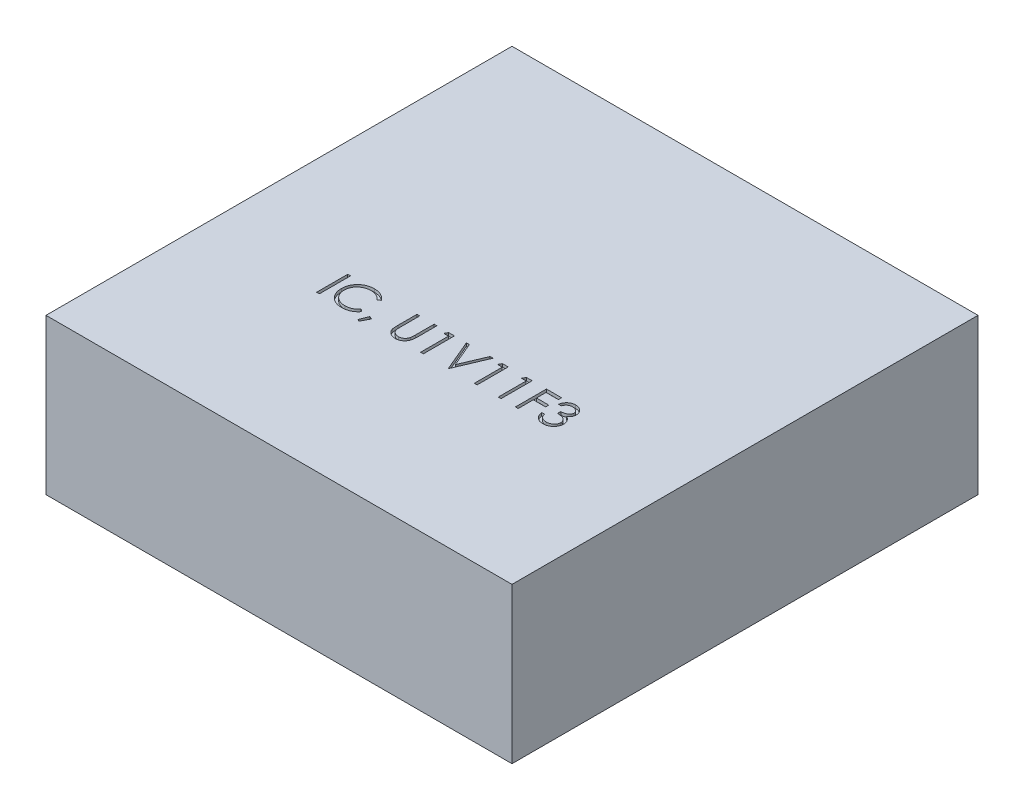
from build123d import *

# Parameters (mm, degrees)
BASES_W          = 3
BASES_H          = 3
BASE_DEPTH       = 1
PARTNUMBERS_W    = 0.017948718
PARTNUMBERS_H    = 0.2
PARTNUMBER_DEPTH = 0.02


with BuildPart() as part:
    # BaseS → Base (new body)
    with BuildSketch(Plane(origin=(0, 0, 0), x_dir=(1, 0, 0), z_dir=(0, 1, 0))):
        Rectangle(BASES_W, BASES_H)
    extrude(amount=BASE_DEPTH)

    # PartNumberS → PartNumber (cut)
    with BuildSketch(Plane(origin=(0, 1, 0), x_dir=(1, 0, 0), z_dir=(0, 1, 0))):
        with BuildLine():
            Line((0.662820513, -0.346153846), (0.644871795, -0.346153846))
            add(Edge.make_bspline(
                [(0.644871795, -0.346153846), (0.645358055, -0.344140561), (0.646308654, -0.340204754), (0.648291372, -0.334581482), (0.650451329, -0.329260138), (0.653044993, -0.324340362), (0.655874064, -0.319723282), (0.659115363, -0.315513618), (0.662619347, -0.311604306), (0.666495058, -0.308134978), (0.670559553, -0.304993393), (0.674870103, -0.302314819), (0.679339982, -0.300010581), (0.684000161, -0.298112282), (0.688864514, -0.296682252), (0.693889064, -0.295644721), (0.699086978, -0.294970943), (0.702615412, -0.294905185), (0.704407051, -0.294871795)],
                knots=[0, 0, 0, 0, 1.162005537, 2.271625781, 3.343758855, 4.383309926, 5.390229558, 6.379919256, 7.361854164, 8.333198761, 9.295911338, 10.242430842, 11.177959212, 12.116337295, 13.062827104, 14.020064771, 14.994644689, 16, 16, 16, 16], degree=3))
            add(Edge.make_bspline(
                [(0.704407051, -0.294871795), (0.707017494, -0.294950608), (0.712181437, -0.295106515), (0.719767897, -0.296530197), (0.727083715, -0.298783062), (0.734048815, -0.301895846), (0.74051844, -0.305735121), (0.746274793, -0.310304535), (0.751239851, -0.315515924), (0.755405244, -0.32127207), (0.758666673, -0.327423814), (0.761071608, -0.333755251), (0.762535704, -0.340251364), (0.76272545, -0.344637494), (0.762820513, -0.346834936)],
                knots=[0, 0, 0, 0, 1.083050992, 2.142477498, 3.193116406, 4.255571735, 5.30263384, 6.308962982, 7.297363603, 8.282367274, 9.249857812, 10.179914175, 11.08814088, 12, 12, 12, 12], degree=3))
            add(Edge.make_bspline(
                [(0.762820513, -0.346834936), (0.762754022, -0.34894961), (0.762623909, -0.353087699), (0.761519126, -0.359128927), (0.759659911, -0.364822733), (0.757084496, -0.370193085), (0.753750693, -0.375205933), (0.749712254, -0.379872555), (0.744940673, -0.38421365), (0.741324734, -0.386700477), (0.739463141, -0.387980769)],
                knots=[0, 0, 0, 0, 1.024540389, 2.004866551, 2.965041327, 3.920577974, 4.882998113, 5.874504559, 6.905732034, 8, 8, 8, 8], degree=3))
            add(Edge.make_bspline(
                [(0.739463141, -0.387980769), (0.74159067, -0.389008093), (0.74580592, -0.391043519), (0.751551664, -0.395035277), (0.756767543, -0.399644211), (0.759676327, -0.403240934), (0.761137821, -0.405048077)],
                knots=[0, 0, 0, 0, 1.015518401, 2.012035669, 3.001164323, 4, 4, 4, 4], degree=3))
            add(Edge.make_bspline(
                [(0.761137821, -0.405048077), (0.762100183, -0.406365663), (0.764009148, -0.408979258), (0.766365465, -0.413181339), (0.768503128, -0.417429996), (0.770168855, -0.421839105), (0.77145879, -0.426357563), (0.772380849, -0.430993128), (0.772953657, -0.435749587), (0.773035689, -0.438967443), (0.773076923, -0.440584936)],
                knots=[0, 0, 0, 0, 1.025084078, 2.033381695, 3.024893161, 4.013698104, 4.991890475, 5.976764909, 6.982997093, 8, 8, 8, 8], degree=3))
            add(Edge.make_bspline(
                [(0.773076923, -0.440584936), (0.772974379, -0.443385491), (0.772769775, -0.448973423), (0.770940971, -0.457229121), (0.768105928, -0.46529915), (0.764079818, -0.473017712), (0.759173103, -0.480239448), (0.753335541, -0.486700952), (0.746633461, -0.492255158), (0.739158852, -0.496895742), (0.731060731, -0.500605338), (0.722399268, -0.503180049), (0.713299265, -0.504856963), (0.707058848, -0.505036784), (0.703886218, -0.505128205)],
                knots=[0, 0, 0, 0, 0.955779014, 1.907060117, 2.875433937, 3.871313158, 4.872415639, 5.851225146, 6.836215519, 7.83643374, 8.849228613, 9.86973379, 10.916971861, 12, 12, 12, 12], degree=3))
            add(Edge.make_bspline(
                [(0.703886218, -0.505128205), (0.701747972, -0.505078593), (0.697540618, -0.504980973), (0.691355275, -0.504313624), (0.685451178, -0.503094767), (0.679820344, -0.501454578), (0.67445777, -0.49937505), (0.669379821, -0.49678541), (0.664555256, -0.493739038), (0.660029602, -0.490199976), (0.655803398, -0.486241042), (0.651988956, -0.481791956), (0.648522682, -0.476934962), (0.645497389, -0.471613644), (0.642775277, -0.465896772), (0.640536365, -0.459711144), (0.638565761, -0.453112057), (0.637649563, -0.448513329), (0.637179487, -0.446153846)],
                knots=[0, 0, 0, 0, 1.048658725, 2.063410685, 3.046034179, 4.001477787, 4.936774919, 5.862367409, 6.792675028, 7.730719943, 8.675894397, 9.627829632, 10.600096036, 11.597688215, 12.626045268, 13.701542398, 14.82072376, 16, 16, 16, 16], degree=3))
            Line((0.637179487, -0.446153846), (0.655128205, -0.446153846))
            add(Edge.make_bspline(
                [(0.655128205, -0.446153846), (0.655595822, -0.44769379), (0.656505377, -0.450689114), (0.658053622, -0.454999988), (0.659817524, -0.458951877), (0.661709784, -0.46257377), (0.663697124, -0.465901336), (0.665920834, -0.468846585), (0.668216214, -0.471538883), (0.669946462, -0.473055718), (0.670793269, -0.473798077)],
                knots=[0, 0, 0, 0, 1.198163088, 2.33053128, 3.407730985, 4.417276592, 5.372219308, 6.28897303, 7.162600585, 8, 8, 8, 8], degree=3))
            add(Edge.make_bspline(
                [(0.670793269, -0.473798077), (0.671913074, -0.47466141), (0.674149226, -0.476385412), (0.677793125, -0.478585505), (0.681625404, -0.480491849), (0.6857291, -0.481948061), (0.690015658, -0.48318107), (0.694554364, -0.483987957), (0.699305177, -0.484541566), (0.702549049, -0.48459042), (0.704206731, -0.484615385)],
                knots=[0, 0, 0, 0, 0.946170439, 1.889420265, 2.845303464, 3.807233317, 4.801018734, 5.828864929, 6.890507805, 8, 8, 8, 8], degree=3))
            add(Edge.make_bspline(
                [(0.704206731, -0.484615385), (0.706078359, -0.48458019), (0.709738168, -0.48451137), (0.715078446, -0.483878473), (0.720158871, -0.482956735), (0.724923038, -0.481533136), (0.729433353, -0.47977423), (0.73362659, -0.477565749), (0.737557796, -0.474974623), (0.741176619, -0.472029528), (0.744430648, -0.468805442), (0.747295763, -0.465433267), (0.749731458, -0.461927219), (0.751696234, -0.458267898), (0.753247694, -0.454470457), (0.754303877, -0.450524238), (0.755038249, -0.446461537), (0.755098056, -0.443699881), (0.755128205, -0.442307692)],
                knots=[0, 0, 0, 0, 1.217147791, 2.380027433, 3.494444702, 4.572153297, 5.609568379, 6.639424714, 7.649109417, 8.668170816, 9.669597737, 10.625200337, 11.543417969, 12.441394052, 13.322311151, 14.205496177, 15.095365482, 16, 16, 16, 16], degree=3))
            add(Edge.make_bspline(
                [(0.755128205, -0.442307692), (0.755040759, -0.440444187), (0.754866303, -0.43672645), (0.753534384, -0.431256874), (0.751343592, -0.425986965), (0.748276591, -0.421006634), (0.744543121, -0.416390868), (0.740179412, -0.412272498), (0.735149227, -0.408874207), (0.730519521, -0.406526283), (0.726418655, -0.404924165), (0.722909204, -0.403857024), (0.718980255, -0.402953387), (0.714679321, -0.402112685), (0.709973994, -0.40139718), (0.704869398, -0.400800505), (0.699364497, -0.400323074), (0.695553574, -0.400109868), (0.693589744, -0.4)],
                knots=[0, 0, 0, 0, 1.07054697, 2.135767047, 3.216561865, 4.33974944, 5.486079747, 6.621378074, 7.775625952, 8.963672916, 9.598146892, 10.304877434, 11.070270905, 11.915000392, 12.823868403, 13.805723172, 14.86925407, 16, 16, 16, 16], degree=3))
            Line((0.693589744, -0.4), (0.693589744, -0.379487179))
            add(Edge.make_bspline(
                [(0.693589744, -0.379487179), (0.696064096, -0.379445191), (0.700910744, -0.379362945), (0.707990419, -0.378368202), (0.714760322, -0.376992166), (0.721070422, -0.37488444), (0.726821777, -0.372436423), (0.731811469, -0.369587726), (0.735969591, -0.366421169), (0.739275938, -0.362887877), (0.741763323, -0.359098445), (0.743581997, -0.355148922), (0.744656301, -0.35100469), (0.744799711, -0.348176423), (0.744871795, -0.346754808)],
                knots=[0, 0, 0, 0, 1.321986639, 2.589447074, 3.816329219, 5.01088745, 6.139805852, 7.153945165, 8.075214402, 8.924034688, 9.728124013, 10.488707548, 11.240355623, 12, 12, 12, 12], degree=3))
            add(Edge.make_bspline(
                [(0.744871795, -0.346754808), (0.744848114, -0.345710365), (0.744801003, -0.343632496), (0.744206873, -0.340596778), (0.74331407, -0.337653867), (0.742086657, -0.334816278), (0.740443789, -0.33210369), (0.738477732, -0.329492979), (0.736136698, -0.326999049), (0.733454101, -0.324674459), (0.730573426, -0.322459074), (0.727416296, -0.320578295), (0.724077904, -0.318970006), (0.720554552, -0.317643748), (0.716834807, -0.316646075), (0.712936147, -0.315929741), (0.708851136, -0.315481875), (0.70606418, -0.315417394), (0.704647436, -0.315384615)],
                knots=[0, 0, 0, 0, 0.884392785, 1.759457502, 2.611959086, 3.489218968, 4.37281399, 5.2945488, 6.255912374, 7.266815255, 8.301784654, 9.332968512, 10.37626691, 11.440494194, 12.520033166, 13.637162961, 14.798855837, 16, 16, 16, 16], degree=3))
            add(Edge.make_bspline(
                [(0.704647436, -0.315384615), (0.702370198, -0.315464122), (0.697922222, -0.315619416), (0.691509941, -0.316979588), (0.685548836, -0.319149765), (0.680992341, -0.321740223), (0.677627622, -0.324297391), (0.675223226, -0.32653067), (0.672862054, -0.329012545), (0.670699444, -0.331895881), (0.668512359, -0.334985412), (0.666521242, -0.338438194), (0.664586402, -0.342164159), (0.663420542, -0.344798195), (0.662820513, -0.346153846)],
                knots=[0, 0, 0, 0, 1.472543308, 2.876219568, 4.221790263, 5.565193594, 6.249813518, 6.953379497, 7.687249741, 8.463570142, 9.283606569, 10.136032583, 11.040678096, 12, 12, 12, 12], degree=3))
        make_face()
        Polygon((0.521794872, -0.3), (0.619230769, -0.3), (0.619230769, -0.320512821), (0.53974359, -0.320512821), (0.53974359, -0.382051282), (0.619230769, -0.382051282), (0.619230769, -0.402564103), (0.53974359, -0.402564103), (0.53974359, -0.5), (0.521794872, -0.5), align=None)
        Polygon((0.392508013, -0.3), (0.429487179, -0.3), (0.429487179, -0.5), (0.411538462, -0.5), (0.411538462, -0.320512821), (0.380769231, -0.320512821), align=None)
        Polygon((0.238661859, -0.3), (0.275641026, -0.3), (0.275641026, -0.5), (0.257692308, -0.5), (0.257692308, -0.320512821), (0.226923077, -0.320512821), align=None)
        Polygon((0.006410256, -0.3), (0.025641026, -0.3), (0.092307692, -0.457612179), (0.158974359, -0.3), (0.178205128, -0.3), (0.093589744, -0.5), (0.091025641, -0.5), align=None)
        Polygon((-0.107491987, -0.3), (-0.070512821, -0.3), (-0.070512821, -0.5), (-0.088461538, -0.5), (-0.088461538, -0.320512821), (-0.119230769, -0.320512821), align=None)
        with BuildLine():
            Line((-0.311538462, -0.3), (-0.293589744, -0.3))
            Line((-0.293589744, -0.3), (-0.293589744, -0.419831731))
            add(Edge.make_bspline(
                [(-0.293589744, -0.419831731), (-0.293592415, -0.421527773), (-0.293597484, -0.424746305), (-0.293563626, -0.429327351), (-0.293468805, -0.433400063), (-0.293409024, -0.43698014), (-0.293276033, -0.440051154), (-0.293167574, -0.442629743), (-0.293028113, -0.444703697), (-0.292860507, -0.445914036), (-0.292788462, -0.446434295)],
                knots=[0, 0, 0, 0, 1.528628734, 2.90083645, 4.128790002, 5.200304208, 6.127813768, 6.898992206, 7.526736466, 8, 8, 8, 8], degree=3))
            add(Edge.make_bspline(
                [(-0.292788462, -0.446434295), (-0.292492607, -0.448311253), (-0.291917568, -0.451959409), (-0.29045206, -0.457154168), (-0.288405346, -0.461835965), (-0.285980029, -0.466150896), (-0.28278388, -0.46997886), (-0.278955106, -0.47350524), (-0.274316377, -0.476589343), (-0.269158628, -0.479409389), (-0.263599472, -0.481675965), (-0.257918828, -0.483389872), (-0.252202086, -0.484434381), (-0.248374877, -0.484555326), (-0.246474359, -0.484615385)],
                knots=[0, 0, 0, 0, 1.035780045, 2.013197591, 2.933192213, 3.817615948, 4.702609284, 5.640816605, 6.646850145, 7.73207398, 8.84249596, 9.914020372, 10.964143139, 12, 12, 12, 12], degree=3))
            add(Edge.make_bspline(
                [(-0.246474359, -0.484615385), (-0.244842717, -0.484554022), (-0.241588856, -0.48443165), (-0.236754203, -0.483673854), (-0.232045625, -0.482308108), (-0.227439872, -0.480545836), (-0.223122673, -0.478217402), (-0.219091619, -0.47552764), (-0.21549368, -0.472372733), (-0.212210366, -0.468881284), (-0.209351227, -0.464941867), (-0.206872876, -0.460640259), (-0.204842823, -0.455911725), (-0.203840335, -0.452588615), (-0.203325321, -0.45088141)],
                knots=[0, 0, 0, 0, 0.994687771, 1.983630487, 2.973142513, 3.978332533, 4.983357753, 5.956394766, 6.925816176, 7.893390482, 8.871859704, 9.88551698, 10.913711441, 12, 12, 12, 12], degree=3))
            add(Edge.make_bspline(
                [(-0.203325321, -0.45088141), (-0.203153885, -0.450175777), (-0.202771857, -0.448603343), (-0.202414883, -0.445944984), (-0.202043081, -0.442808449), (-0.201785106, -0.439171202), (-0.201533608, -0.435045432), (-0.201383146, -0.430409646), (-0.201313602, -0.425280677), (-0.201292877, -0.421701411), (-0.201282051, -0.419831731)],
                knots=[0, 0, 0, 0, 0.558680831, 1.244966039, 2.062412453, 2.990489873, 4.051219941, 5.244515665, 6.560634259, 8, 8, 8, 8], degree=3))
            Line((-0.201282051, -0.419831731), (-0.201282051, -0.3))
            Line((-0.201282051, -0.3), (-0.183333333, -0.3))
            Line((-0.183333333, -0.3), (-0.183333333, -0.420793269))
            add(Edge.make_bspline(
                [(-0.183333333, -0.420793269), (-0.183347854, -0.422970319), (-0.183376193, -0.427218965), (-0.183621941, -0.433444757), (-0.184013769, -0.439350642), (-0.184567374, -0.444937413), (-0.185300917, -0.450185079), (-0.186116644, -0.455139638), (-0.187155475, -0.459765523), (-0.188368812, -0.464098804), (-0.189755872, -0.46822369), (-0.191552509, -0.472138468), (-0.193576766, -0.475962148), (-0.195977603, -0.479636897), (-0.198675397, -0.483178986), (-0.201729778, -0.486566933), (-0.20503973, -0.489854879), (-0.208660277, -0.492958483), (-0.212531735, -0.495804693), (-0.21664259, -0.498307422), (-0.220961262, -0.500423058), (-0.225476527, -0.502164539), (-0.23019031, -0.503473945), (-0.23510273, -0.504449668), (-0.24022497, -0.505004085), (-0.243708665, -0.505086481), (-0.245472756, -0.505128205)],
                knots=[0, 0, 0, 0, 1.316592851, 2.569410997, 3.76748051, 4.895814652, 5.963796859, 6.97159953, 7.931736103, 8.829262218, 9.692595152, 10.560224239, 11.431080259, 12.30701507, 13.211635791, 14.121146779, 15.063487852, 16.031507147, 17.00238618, 17.966455255, 18.938106653, 19.907068911, 20.888905087, 21.893141452, 22.933117798, 24, 24, 24, 24], degree=3))
            add(Edge.make_bspline(
                [(-0.245472756, -0.505128205), (-0.247396705, -0.505083361), (-0.251171486, -0.504995378), (-0.256733661, -0.504491221), (-0.262065901, -0.503541598), (-0.267224522, -0.502332459), (-0.272139294, -0.500664817), (-0.276876062, -0.498716352), (-0.281353701, -0.496323366), (-0.285644851, -0.493660887), (-0.289634837, -0.490665193), (-0.293297546, -0.48740004), (-0.296639024, -0.483917733), (-0.29960295, -0.480180569), (-0.302238429, -0.476217614), (-0.304508727, -0.472017658), (-0.306458055, -0.467582325), (-0.307464144, -0.464499285), (-0.307972756, -0.462940705)],
                knots=[0, 0, 0, 0, 1.13879206, 2.234305948, 3.301075583, 4.341971843, 5.366689343, 6.369221514, 7.369726634, 8.367512178, 9.355451585, 10.318319045, 11.268648973, 12.207971039, 13.137398894, 14.081662264, 15.030215811, 16, 16, 16, 16], degree=3))
            add(Edge.make_bspline(
                [(-0.307972756, -0.462940705), (-0.308268594, -0.461875987), (-0.308910272, -0.459566588), (-0.309597432, -0.455744503), (-0.310175094, -0.451343651), (-0.310718269, -0.44636373), (-0.311038781, -0.44080088), (-0.311319777, -0.434657514), (-0.311540441, -0.427926202), (-0.31153914, -0.423237372), (-0.311538462, -0.420793269)],
                knots=[0, 0, 0, 0, 0.625038921, 1.35572334, 2.194682327, 3.136881307, 4.189498639, 5.346923369, 6.617055217, 8, 8, 8, 8], degree=3))
            Line((-0.311538462, -0.420793269), (-0.311538462, -0.3))
        make_face()
        Polygon((-0.450400641, -0.464102564), (-0.432051282, -0.472996795), (-0.459615385, -0.525641026), (-0.473076923, -0.519791667), align=None)
        with BuildLine():
            Line((-0.503846154, -0.336698718), (-0.519551282, -0.348717949))
            add(Edge.make_bspline(
                [(-0.519551282, -0.348717949), (-0.520671619, -0.34738275), (-0.522897187, -0.344730355), (-0.526477713, -0.34100581), (-0.530209235, -0.337516366), (-0.534090328, -0.334245402), (-0.538190849, -0.331307301), (-0.542411466, -0.328548952), (-0.546822783, -0.32607651), (-0.552922882, -0.323078625), (-0.560902759, -0.319950273), (-0.570948178, -0.317327232), (-0.581434527, -0.31565745), (-0.588588675, -0.315476602), (-0.592227564, -0.315384615)],
                knots=[0, 0, 0, 0, 0.757959112, 1.505699292, 2.245454638, 2.979532153, 3.711538275, 4.438200793, 5.171680507, 5.909471876, 7.393775596, 8.890124382, 10.418191784, 12, 12, 12, 12], degree=3))
            add(Edge.make_bspline(
                [(-0.592227564, -0.315384615), (-0.594232324, -0.315407699), (-0.598223238, -0.315453652), (-0.604146008, -0.316059888), (-0.609958182, -0.316911957), (-0.61565598, -0.318176261), (-0.621232149, -0.319774696), (-0.626723144, -0.32168472), (-0.632049464, -0.324047854), (-0.637284792, -0.326659754), (-0.642300747, -0.329609894), (-0.647046749, -0.3328278), (-0.65150549, -0.336277462), (-0.655680497, -0.339971811), (-0.659576037, -0.343894209), (-0.663163883, -0.348086457), (-0.666431621, -0.352535153), (-0.669444022, -0.357181633), (-0.672141893, -0.362012364), (-0.674400743, -0.367045225), (-0.676401036, -0.372194031), (-0.677983849, -0.377516955), (-0.679236679, -0.382976541), (-0.680101117, -0.388587443), (-0.680700458, -0.394337939), (-0.680746182, -0.398235614), (-0.680769231, -0.400200321)],
                knots=[0, 0, 0, 0, 1.054917814, 2.100044995, 3.131103042, 4.146048494, 5.169673617, 6.183595914, 7.203665975, 8.234915748, 9.262203917, 10.264457458, 11.251630812, 12.227803204, 13.197192746, 14.159520551, 15.12972552, 16.100847026, 17.073214652, 18.039054194, 19.002613845, 19.979014051, 20.95965708, 21.949030935, 22.966165397, 24, 24, 24, 24], degree=3))
            add(Edge.make_bspline(
                [(-0.680769231, -0.400200321), (-0.680697127, -0.403156396), (-0.68055556, -0.408960258), (-0.679295655, -0.417461436), (-0.677381079, -0.425605474), (-0.674511617, -0.433341465), (-0.670973386, -0.4407648), (-0.666502494, -0.447749877), (-0.661324406, -0.454402252), (-0.655365868, -0.460564707), (-0.648828392, -0.466194062), (-0.641814226, -0.471151238), (-0.634340838, -0.475283517), (-0.626490745, -0.478722143), (-0.618203539, -0.481365384), (-0.609494121, -0.483226191), (-0.600381436, -0.48444003), (-0.594154613, -0.484556241), (-0.590985577, -0.484615385)],
                knots=[0, 0, 0, 0, 1.029171465, 2.020641659, 2.987623507, 3.938342917, 4.889210282, 5.84687017, 6.821220943, 7.821438502, 8.827599549, 9.822697543, 10.807740252, 11.797342354, 12.80366471, 13.83203677, 14.896651826, 16, 16, 16, 16], degree=3))
            add(Edge.make_bspline(
                [(-0.590985577, -0.484615385), (-0.587493995, -0.484518883), (-0.580621726, -0.484328944), (-0.570543553, -0.482719845), (-0.560895795, -0.480110821), (-0.551677933, -0.476459511), (-0.542915953, -0.471712923), (-0.534596144, -0.465958759), (-0.526711482, -0.459142282), (-0.521970266, -0.453937532), (-0.519551282, -0.451282051)],
                knots=[0, 0, 0, 0, 1.028121516, 2.023589091, 2.998037872, 3.967518031, 4.937445131, 5.927275754, 6.942489185, 8, 8, 8, 8], degree=3))
            Line((-0.519551282, -0.451282051), (-0.503846154, -0.46318109))
            add(Edge.make_bspline(
                [(-0.503846154, -0.46318109), (-0.505110046, -0.464811858), (-0.507631776, -0.468065584), (-0.511715091, -0.472652539), (-0.516016651, -0.476967056), (-0.520568406, -0.480974348), (-0.525317994, -0.484754603), (-0.530350697, -0.488200422), (-0.535600356, -0.491359902), (-0.541049184, -0.494252869), (-0.54669139, -0.496819568), (-0.552520215, -0.499016927), (-0.558510534, -0.500909777), (-0.56466262, -0.502467031), (-0.570989235, -0.503682521), (-0.577467547, -0.504495074), (-0.58411154, -0.505051755), (-0.588593907, -0.505102493), (-0.590865385, -0.505128205)],
                knots=[0, 0, 0, 0, 0.986787822, 1.968848986, 2.935600012, 3.899624008, 4.868462664, 5.837806735, 6.815139263, 7.798259679, 8.787526145, 9.778297419, 10.776456485, 11.791383307, 12.812564526, 13.85620153, 14.913611965, 16, 16, 16, 16], degree=3))
            add(Edge.make_bspline(
                [(-0.590865385, -0.505128205), (-0.593016451, -0.505113234), (-0.597269919, -0.505083631), (-0.603549848, -0.504604078), (-0.609663538, -0.503949808), (-0.615593517, -0.502964657), (-0.621372144, -0.501802124), (-0.626947035, -0.500243766), (-0.632373047, -0.498498099), (-0.63762838, -0.496446386), (-0.642717506, -0.494131176), (-0.64762401, -0.491514515), (-0.652345634, -0.488618408), (-0.656928801, -0.485506694), (-0.661305806, -0.482079419), (-0.665514579, -0.478384183), (-0.66957872, -0.474433439), (-0.67209316, -0.471584591), (-0.673357372, -0.470152244)],
                knots=[0, 0, 0, 0, 1.114604814, 2.203992996, 3.262667896, 4.300477797, 5.318619304, 6.316056647, 7.298880507, 8.271930387, 9.238335007, 10.195173496, 11.151986948, 12.108099108, 13.064862484, 14.031167946, 15.010108607, 16, 16, 16, 16], degree=3))
            add(Edge.make_bspline(
                [(-0.673357372, -0.470152244), (-0.675382266, -0.467664176), (-0.679407607, -0.462718078), (-0.684557646, -0.454701736), (-0.688966078, -0.446332124), (-0.692530416, -0.437565271), (-0.695316858, -0.428420849), (-0.697247212, -0.418894248), (-0.69850159, -0.408994366), (-0.698645035, -0.402260835), (-0.698717949, -0.398838141)],
                knots=[0, 0, 0, 0, 0.994628077, 1.977248131, 2.950237994, 3.925870899, 4.908910175, 5.911660606, 6.938484602, 8, 8, 8, 8], degree=3))
            add(Edge.make_bspline(
                [(-0.698717949, -0.398838141), (-0.698629081, -0.395240687), (-0.698454238, -0.388162919), (-0.696968764, -0.377775836), (-0.694579118, -0.367824328), (-0.69118501, -0.358326971), (-0.686881847, -0.349233812), (-0.681566041, -0.340614315), (-0.675299347, -0.332413355), (-0.668130915, -0.324755369), (-0.660269924, -0.31775312), (-0.651851706, -0.311592766), (-0.642892738, -0.306466051), (-0.633491718, -0.302180556), (-0.62357825, -0.298886586), (-0.613173486, -0.29658069), (-0.602296977, -0.295145426), (-0.594876267, -0.294963986), (-0.591105769, -0.294871795)],
                knots=[0, 0, 0, 0, 1.032925535, 2.032216505, 3.007276963, 3.968222605, 4.92396291, 5.891752235, 6.871517503, 7.883894988, 8.900124299, 9.891468569, 10.874487609, 11.85992873, 12.854644235, 13.869047385, 14.917252991, 16, 16, 16, 16], degree=3))
            add(Edge.make_bspline(
                [(-0.591105769, -0.294871795), (-0.588807799, -0.294899346), (-0.5842592, -0.29495388), (-0.577530477, -0.295485659), (-0.570979486, -0.296372151), (-0.564601716, -0.297578783), (-0.558366138, -0.299076345), (-0.55232041, -0.301027219), (-0.546429056, -0.303257878), (-0.540729233, -0.305826933), (-0.535248287, -0.308710747), (-0.529987926, -0.311877354), (-0.524989934, -0.315322828), (-0.520219143, -0.319017867), (-0.51575536, -0.323040642), (-0.511471846, -0.327280505), (-0.507514071, -0.33185958), (-0.505071031, -0.335082719), (-0.503846154, -0.336698718)],
                knots=[0, 0, 0, 0, 1.096760587, 2.17092713, 3.219439832, 4.250915756, 5.268269357, 6.278326846, 7.281116186, 8.274029601, 9.260640565, 10.235837813, 11.203064059, 12.156899882, 13.114053108, 14.069676657, 15.032185724, 16, 16, 16, 16], degree=3))
        make_face()
        with Locations((-0.748717949, -0.4)):
            Rectangle(PARTNUMBERS_W, PARTNUMBERS_H)
    extrude(amount=-PARTNUMBER_DEPTH, mode=Mode.SUBTRACT)


solid = part.part
